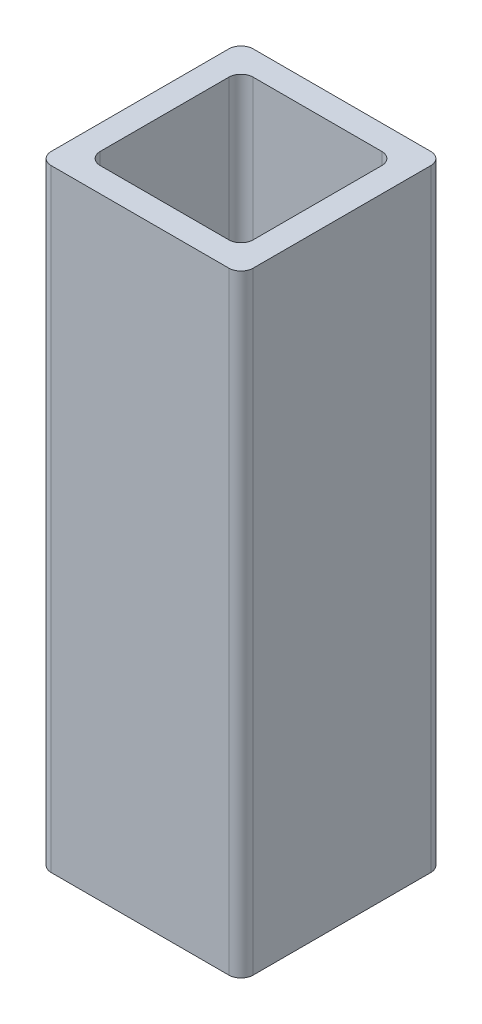
from build123d import *

# Parameters (mm, degrees)
CROQUIS1_W              = 16.5
CROQUIS1_H              = 16.5
CROQUIS1_W_2            = 12.5
CROQUIS1_H_2            = 12.5
SALIENTE_EXTRUIR1_DEPTH = 50
REDONDEO1_R             = 1


with BuildPart() as part:
    # Croquis1 → Saliente-Extruir1 (new body)
    with BuildSketch(Plane(origin=(0, 0, 0), x_dir=(1, 0, 0), z_dir=(0, 1, 0))):
        Rectangle(CROQUIS1_W, CROQUIS1_H)
        Rectangle(CROQUIS1_W_2, CROQUIS1_H_2, mode=Mode.SUBTRACT)
    extrude(amount=SALIENTE_EXTRUIR1_DEPTH)

    # Redondeo1
    redondeo1_edges = [part.edges().sort_by_distance(p)[0] for p in [
        (-6.25, 25, -6.25),
        (-6.25, 25, 6.25),
        (6.25, 25, 6.25),
        (6.25, 25, -6.25),
        (-8.25, 25, -8.25),
        (8.25, 25, -8.25),
        (8.25, 25, 8.25),
        (-8.25, 25, 8.25),
    ]]
    fillet(redondeo1_edges, radius=REDONDEO1_R)


solid = part.part
